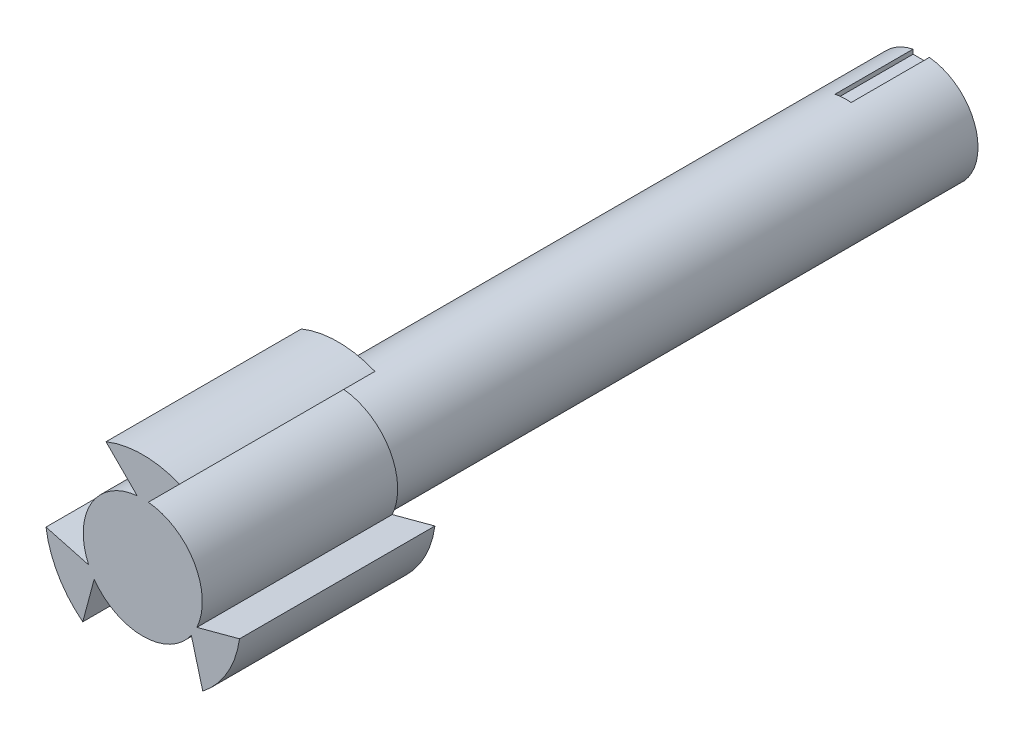
from build123d import *

# Parameters (mm, degrees)
BOSS_EXTRUDE1_DEPTH = 200
SKETCH2_R           = 55
BOSS_EXTRUDE2_DEPTH = 800
SKETCH4_W           = 16.611577021
SKETCH4_H           = 12.619068182
CUT_EXTRUDE1_DEPTH  = 80
ECHELLE1_SCALE      = 0.47


with BuildPart() as part:
    # Sketch1 → Boss-Extrude1 (new body)
    with BuildSketch(Plane.XY):
        with BuildLine():
            Line((-5.678147225, 60.678147225), (-37.644071104, 92.644071104))
            ThreePointArc((-37.644071104, 92.644071104), (0, 100), (37.644071104, 92.644071104))
            Line((37.644071104, 92.644071104), (5.678147225, 60.678147225))
            ThreePointArc((5.678147225, 60.678147225), (52.778396906, 30.471621661), (55.387890564, -25.421653869))
            Line((55.387890564, -25.421653869), (99.054154638, -13.721313674))
            ThreePointArc((99.054154638, -13.721313674), (86.602540378, -50), (61.410083534, -78.92275743))
            Line((61.410083534, -78.92275743), (49.709743339, -35.256493356))
            ThreePointArc((49.709743339, -35.256493356), (0, -60.943243322), (-49.709743339, -35.256493356))
            Line((-49.709743339, -35.256493356), (-61.410083534, -78.92275743))
            ThreePointArc((-61.410083534, -78.92275743), (-86.602540378, -50), (-99.054154638, -13.721313674))
            Line((-99.054154638, -13.721313674), (-55.387890564, -25.421653869))
            ThreePointArc((-55.387890564, -25.421653869), (-52.778396906, 30.471621661), (-5.678147225, 60.678147225))
        make_face()
    extrude(amount=BOSS_EXTRUDE1_DEPTH)

    # Sketch2 → Boss-Extrude2 (add)
    with BuildSketch(Plane.XY.offset(200)):
        Circle(SKETCH2_R)
    extrude(amount=-BOSS_EXTRUDE2_DEPTH)

    # Sketch4 → Cut-Extrude1 (cut)
    with BuildSketch(Plane(origin=(0, 0, -600), x_dir=(-1, 0, 0), z_dir=(0, 0, -1))):
        with Locations((3.127329512, 55.580565651)):
            Rectangle(SKETCH4_W, SKETCH4_H)
    extrude(amount=-CUT_EXTRUDE1_DEPTH, mode=Mode.SUBTRACT)


with BuildPart() as part_1:
    # Echelle1: scaled about (0.002291637, -0.041310048, -150.628565955)
    add(part.part.scale(ECHELLE1_SCALE).moved(Location((0.001214568, -0.021894325, -79.833139956))))


solid = part_1.part
